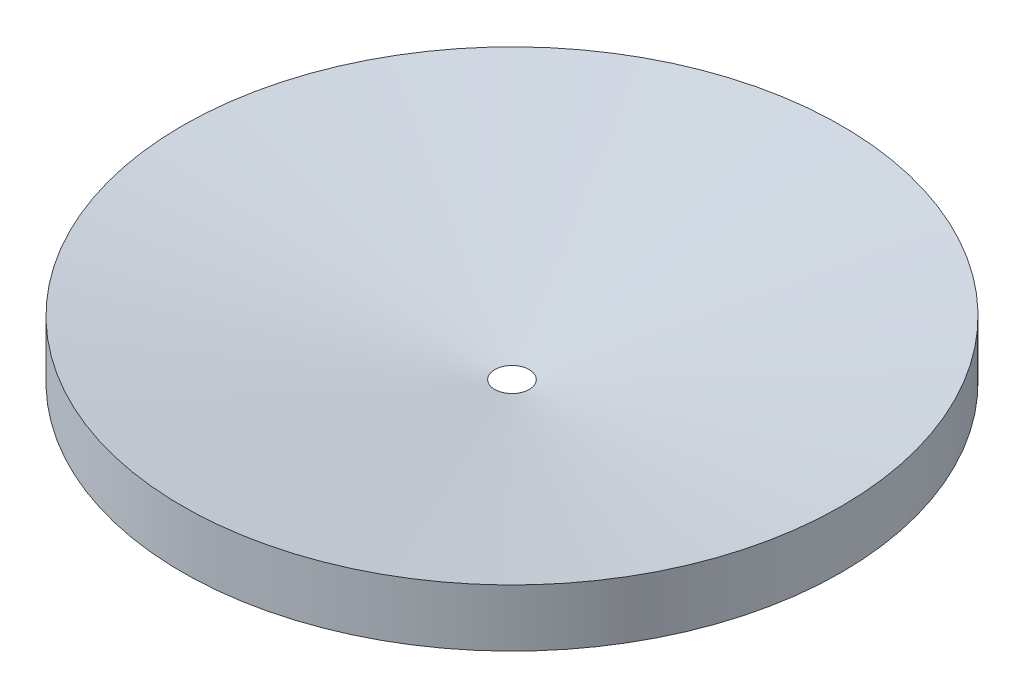
from build123d import *


with BuildPart() as part:
    # Sketch1 → Revolve1 (revolve)
    with BuildSketch(Plane.XY, mode=Mode.PRIVATE) as revolve1_sk:
        Polygon((57.5, 10), (3, 0.390179551), (5.879385242, 0.390179551), (56, 9.227796223), (56, 0), (57.5, 0), align=None)
    revolve(revolve1_sk.sketch.rotate(Axis((0, 10, 0), (0, -1, 0)), 180), axis=Axis((0, 10, 0), (0, -1, 0)))


solid = part.part
